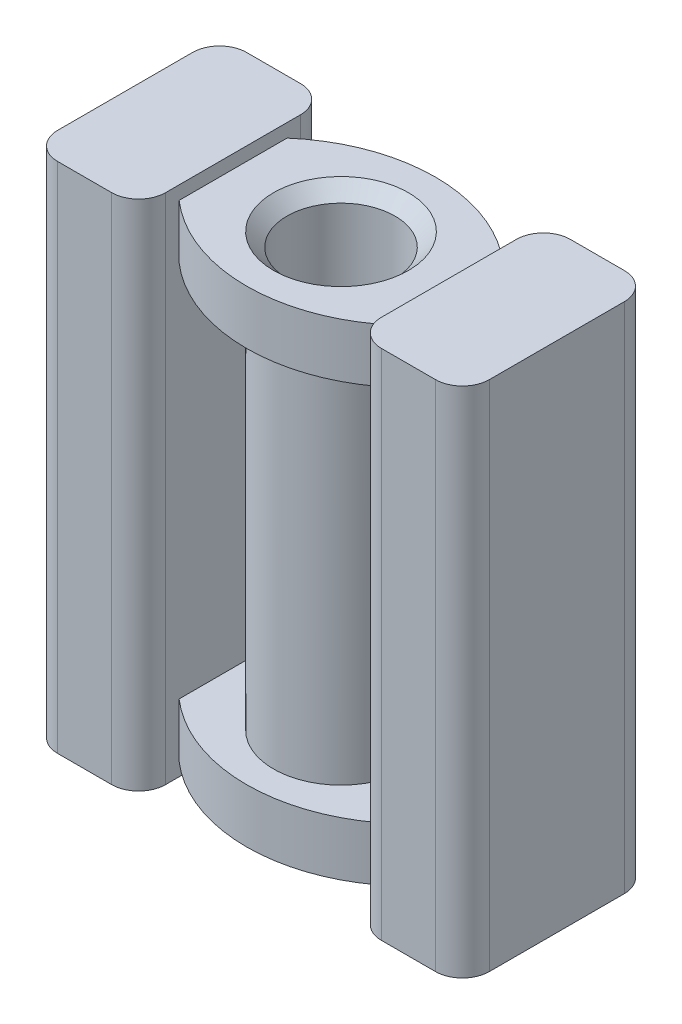
from build123d import *

# Parameters (mm, degrees)
SKETCH1_R             = 1.25
BOSS_EXTRUDE1_DEPTH   = 4.5
BOSS_EXTRUDE2_START   = -3.5
BOSS_EXTRUDE2_DEPTH   = 1
SKETCH3_W             = 2
SKETCH3_H             = 3.5
BOSS_EXTRUDE3_DEPTH   = 4.75
FILLET2_R             = 0.5
F_2_0MM_DOWEL_HOLE1_D = 2
CHAMFER1_SIZE         = 0.25


with BuildPart() as part:
    # Sketch1 → Boss-Extrude1 (new, symmetric)
    with BuildSketch(Plane(origin=(0, 0, 0), x_dir=(1, 0, 0), z_dir=(0, 1, 0))):
        with Locations(Location((0, 0, 0), (0, 0, 270))):
            Circle(SKETCH1_R)
    extrude(amount=BOSS_EXTRUDE1_DEPTH, both=True)

    # Sketch2 → Boss-Extrude2 (add)
    with BuildSketch(Plane(origin=(0, 0, 0), x_dir=(1, 0, 0), z_dir=(0, 1, 0)).offset(BOSS_EXTRUDE2_START)):
        with BuildLine():
            Line((-2, -1), (-2, 1))
            ThreePointArc((-2, 1), (0, 1.75), (2, 1))
            Line((2, 1), (2, -1))
            ThreePointArc((2, -1), (0, -1.75), (-2, -1))
        make_face()
    boss_extrude2 = extrude(amount=-BOSS_EXTRUDE2_DEPTH)

    # Mirror2: Boss-Extrude2 across plane
    add(boss_extrude2.mirror(Plane.ZX))

    # Sketch3 → Boss-Extrude3 (add, symmetric)
    with BuildSketch(Plane(origin=(0, 0, 0), x_dir=(1, 0, 0), z_dir=(0, 1, 0))):
        with Locations((-3, 0)):
            Rectangle(SKETCH3_W, SKETCH3_H)
    boss_extrude3 = extrude(amount=BOSS_EXTRUDE3_DEPTH, both=True)

    # Mirror3: Boss-Extrude3 across plane
    add(boss_extrude3.mirror(Plane(origin=(0, 0, 0), x_dir=(0, 0, 1), z_dir=(1, 0, 0))))

    # Fillet2
    fillet2_edges = [part.edges().sort_by_distance(p)[0] for p in [
        (-2, 0, 1.75),
        (-4, 0, -1.75),
        (-4, 0, 1.75),
        (-2, 0, -1.75),
        (2, 0, -1.75),
        (4, 0, 1.75),
        (4, 0, -1.75),
        (2, 0, 1.75),
    ]]
    fillet(fillet2_edges, radius=FILLET2_R)

    # Ø2.0mm Dowel Hole1 (through all)
    with Locations(Plane(origin=(0, 4.5, 0), x_dir=(1, 0, 0), z_dir=(0, 1, 0))):
        with Locations((0, 0)):
            Hole(F_2_0MM_DOWEL_HOLE1_D / 2)

    # Chamfer1
    chamfer1_edges = [part.edges().sort_by_distance(p)[0] for p in [
        (1, -4.5, 0),
        (1, 4.5, 0),
    ]]
    chamfer(chamfer1_edges, length=CHAMFER1_SIZE)


solid = part.part
